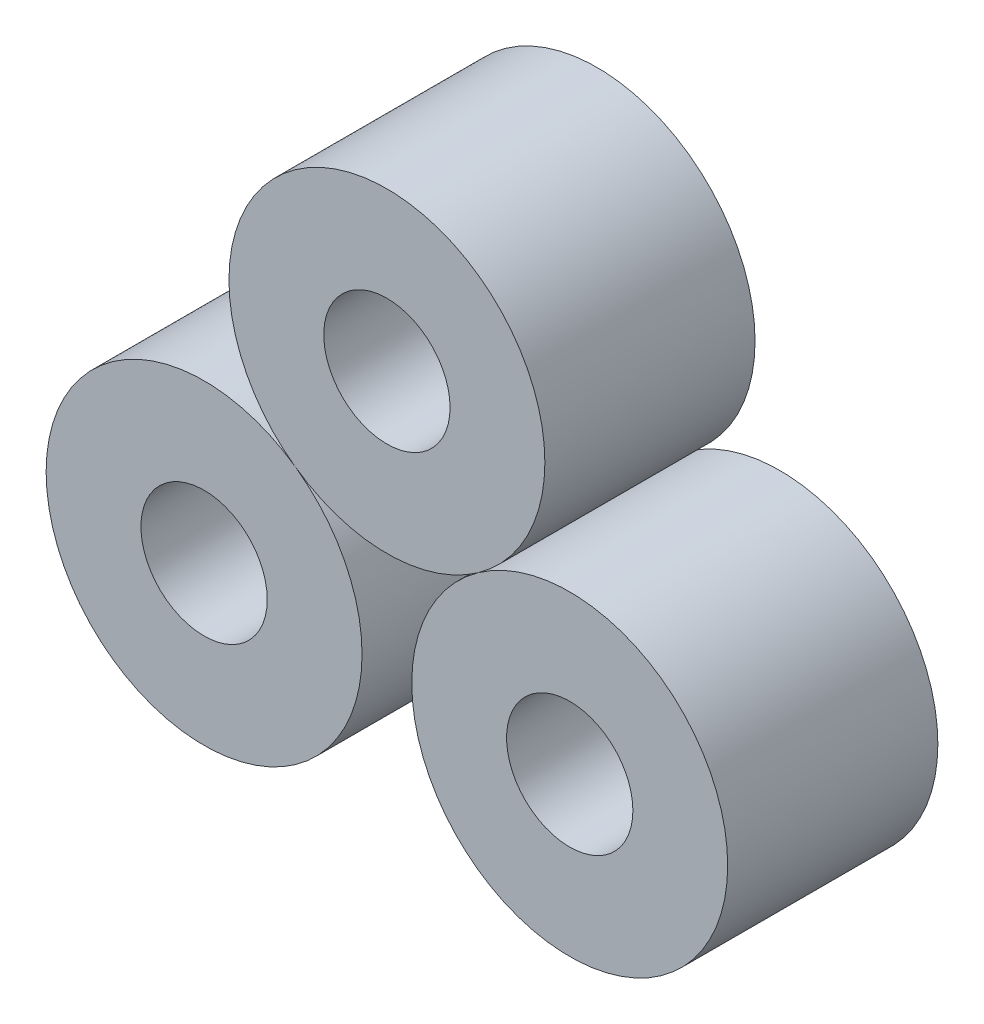
from build123d import *

# Parameters (mm, degrees)
SZKIC1_R                      = 953
SZKIC1_R_2                    = 381
DODANIE_WYCI_GNI_CIE1_DEPTH   = 1268
DODANIE_WYCI_GNI_CIE1_2_DEPTH = 1268
DODANIE_WYCI_GNI_CIE1_3_DEPTH = 1268


with BuildPart() as part:
    # Szkic1 → Dodanie-wyciągnięcie1 (new body)
    with BuildSketch(Plane.XY):
        Circle(SZKIC1_R)
        Circle(SZKIC1_R_2, mode=Mode.SUBTRACT)
    extrude(amount=DODANIE_WYCI_GNI_CIE1_DEPTH)


with BuildPart() as body_2:
    # Szkic1 → Dodanie-wyci_gni_cie1 2 (new body)
    with BuildSketch(Plane.XY):
        with Locations((2206, 0)):
            Circle(SZKIC1_R)
        with Locations((2206, 0)):
            Circle(SZKIC1_R_2, mode=Mode.SUBTRACT)
    extrude(amount=DODANIE_WYCI_GNI_CIE1_2_DEPTH)


with BuildPart() as body_3:
    # Szkic1 → Dodanie-wyci_gni_cie1 3 (new body)
    with BuildSketch(Plane.XY):
        with Locations((1103, 1554.421757439)):
            Circle(SZKIC1_R)
        with Locations((1103, 1554.421757439)):
            Circle(SZKIC1_R_2, mode=Mode.SUBTRACT)
    extrude(amount=DODANIE_WYCI_GNI_CIE1_3_DEPTH)


solid = Compound([part.part, body_2.part, body_3.part])
